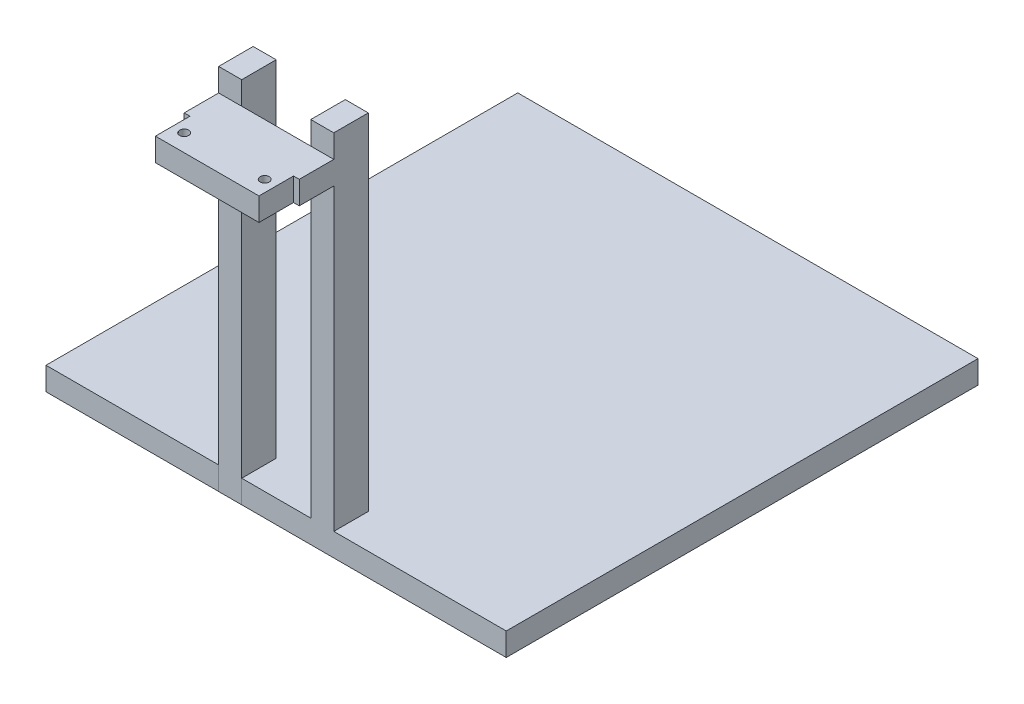
from build123d import *

# Parameters (mm, degrees)
SKETCH2_W           = 200
SKETCH2_H           = 205
BOSS_EXTRUDE1_DEPTH = 10
SKETCH3_W           = 10
SKETCH3_H           = 15
BOSS_EXTRUDE3_DEPTH = 160
SKETCH8_W           = 49.999986941
SKETCH8_H           = 10
BOSS_EXTRUDE4_DEPTH = 15
BOSS_EXTRUDE5_DEPTH = 15
SKETCH10_R          = 2
CUT_EXTRUDE1_DEPTH  = 10


with BuildPart() as part:
    # Sketch2 → Boss-Extrude1 (new body)
    with BuildSketch(Plane(origin=(0, 0, 0), x_dir=(1, 0, 0), z_dir=(0, 1, 0))):
        Rectangle(SKETCH2_W, SKETCH2_H)
    extrude(amount=BOSS_EXTRUDE1_DEPTH)

    # Sketch3 → Boss-Extrude3 (add)
    with BuildSketch(Plane(origin=(0, 0, 0), x_dir=(1, 0, 0), z_dir=(0, 1, 0))):
        Polygon((-14.947609587, -102.515331482), (-24.947604363, -102.525552471), (-24.962935845, -87.525560306), (-14.962941069, -87.515339317), align=None)
        with Locations((20.052382578, -95)):
            Rectangle(SKETCH3_W, SKETCH3_H)
    extrude(amount=BOSS_EXTRUDE3_DEPTH)

    # Sketch8 → Boss-Extrude4 (add)
    with BuildSketch(Plane.XY.offset(102.5)):
        with Locations((0.052389108, 145)):
            Rectangle(SKETCH8_W, SKETCH8_H)
    extrude(amount=BOSS_EXTRUDE4_DEPTH)

    # Sketch9 → Boss-Extrude5 (add)
    with BuildSketch(Plane.XY.offset(117.5)):
        Polygon((0.052389108, 150), (22.552389108, 150), (22.552389108, 140), (-22.447610892, 140), (-22.447610892, 150), align=None)
    extrude(amount=BOSS_EXTRUDE5_DEPTH)

    # Sketch10 → Cut-Extrude1 (cut)
    with BuildSketch(Plane(origin=(0, 150, 0), x_dir=(1, 0, 0), z_dir=(0, 1, 0))):
        with Locations(Location((17.552389108, -125, 0), (0, 0, 270))):
            Circle(SKETCH10_R)
        with Locations(Location((-17.447610892, -125, 0), (0, 0, 270))):
            Circle(SKETCH10_R)
    extrude(amount=-CUT_EXTRUDE1_DEPTH, mode=Mode.SUBTRACT)


solid = part.part
